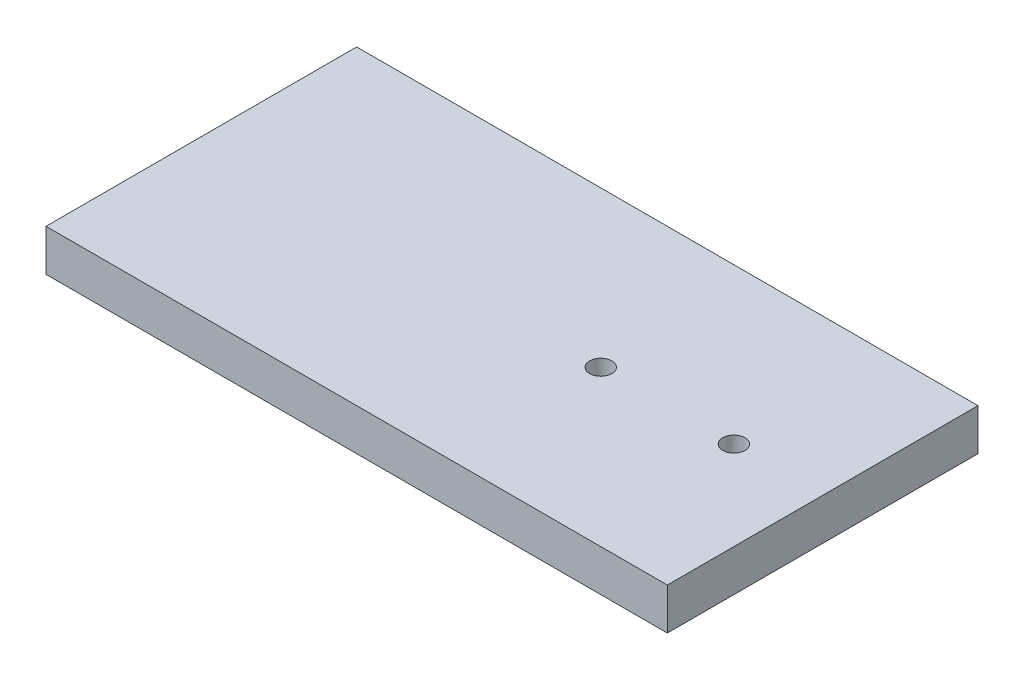
from build123d import *

# Parameters (mm, degrees)
SKETCH1_W                   = 177.8
SKETCH1_H                   = 88.9
BOSS_EXTRUDE1_DEPTH         = 11.90625
F_1_4_0_25_DIAMETER_HOLE1_D = 6.35


with BuildPart() as part:
    # Sketch1 → Boss-Extrude1 (new body)
    with BuildSketch(Plane(origin=(0, 0, 0), x_dir=(1, 0, 0), z_dir=(0, 1, 0))):
        Rectangle(SKETCH1_W, SKETCH1_H)
    extrude(amount=BOSS_EXTRUDE1_DEPTH)

    # 1/4 (0.25) Diameter Hole1 (through all)
    with Locations(Plane(origin=(0, 0, 0), x_dir=(-1, 0, 0), z_dir=(0, -1, 0))):
        with Locations((-63.5, 0), (-25.4, 0)):
            Hole(F_1_4_0_25_DIAMETER_HOLE1_D / 2)


solid = part.part
